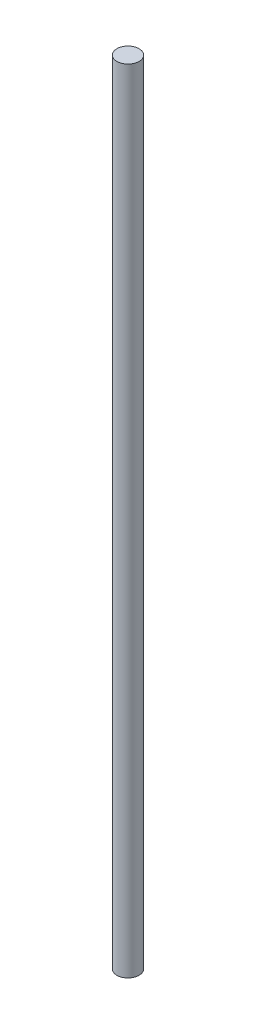
from build123d import *

# Parameters (mm, degrees)
SKETCH_1_R      = 1.4
EXTRUDE_1_DEPTH = 100


with BuildPart() as part:
    # 草图1 → 凸台-拉伸1 (new body)
    with BuildSketch(Plane(origin=(0, 0, 0), x_dir=(1, 0, 0), z_dir=(0, 1, 0))):
        with Locations(Location((0, 0, 0), (0, 0, 270))):
            Circle(SKETCH_1_R)
    extrude(amount=EXTRUDE_1_DEPTH)


solid = part.part
